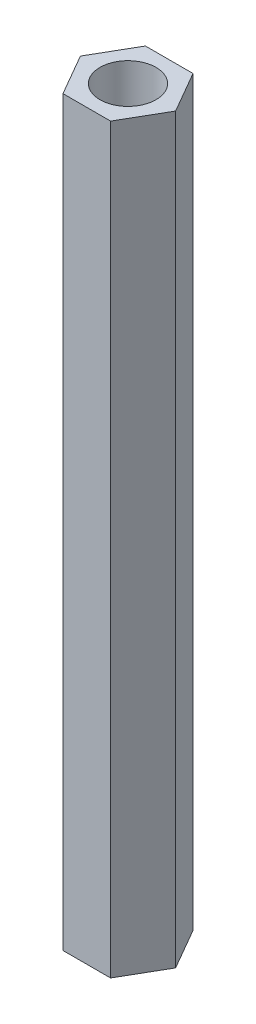
from build123d import *

# Parameters (mm, degrees)
SKETCH_1_R      = 1.7
EXTRUDE_1_DEPTH = 45


with BuildPart() as part:
    # 草图1 → 凸台-拉伸1 (new body)
    with BuildSketch(Plane(origin=(0, 0, 0), x_dir=(1, 0, 0), z_dir=(0, 1, 0))):
        Polygon((2.886751346, 0), (1.443375673, 2.5), (-1.443375673, 2.5), (-2.886751346, 0), (-1.443375673, -2.5), (1.443375673, -2.5), align=None)
        with Locations(Location((0, 0, 0), (0, 0, 90))):
            Circle(SKETCH_1_R, mode=Mode.SUBTRACT)
    extrude(amount=EXTRUDE_1_DEPTH)


solid = part.part
